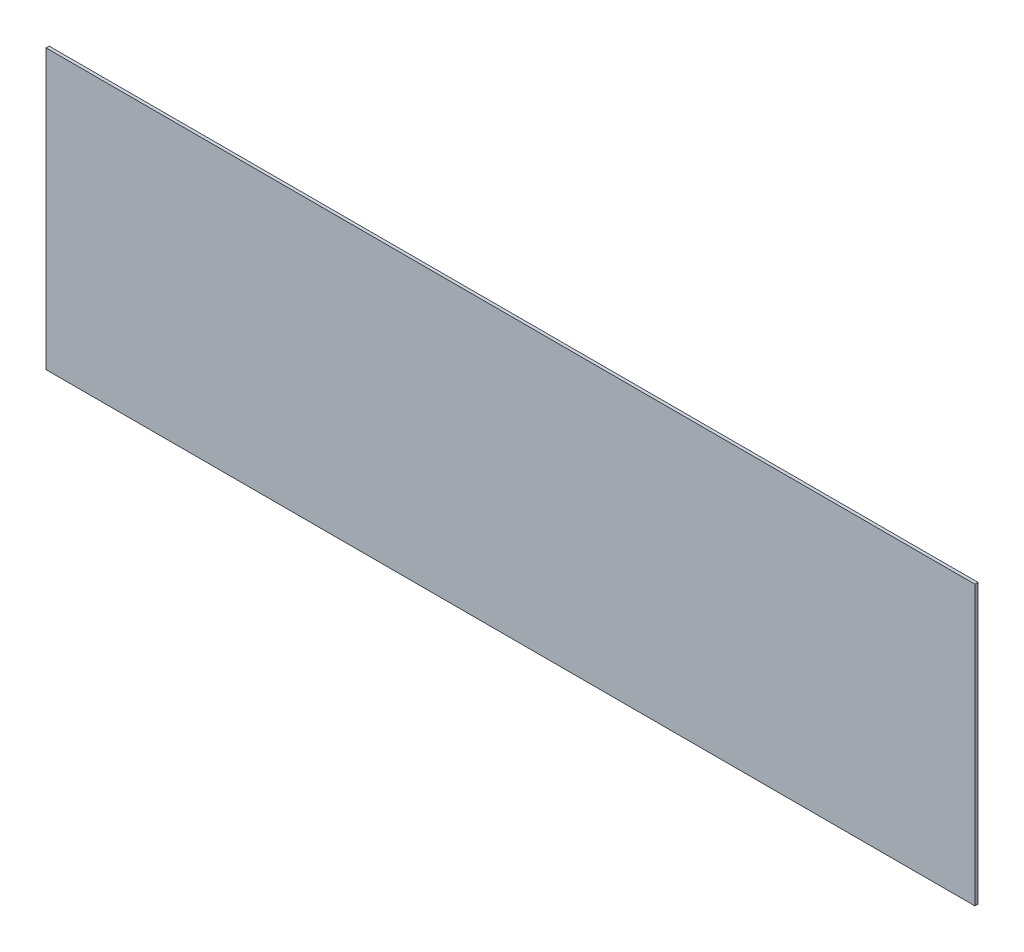
from build123d import *

# Parameters (mm, degrees)
OVEN_PANO_PLAKASI_1_START = -248
SKETCH1_W                 = 600
SKETCH1_H                 = 180
OVEN_PANO_PLAKASI_1_DEPTH = 2


with BuildPart() as part:
    # Sketch1 → OVEN_pano_plakasi_1 (new body)
    with BuildSketch(Plane.XY.offset(OVEN_PANO_PLAKASI_1_START)):
        with Locations((350, 220)):
            Rectangle(SKETCH1_W, SKETCH1_H)
    extrude(amount=-OVEN_PANO_PLAKASI_1_DEPTH)


solid = part.part
